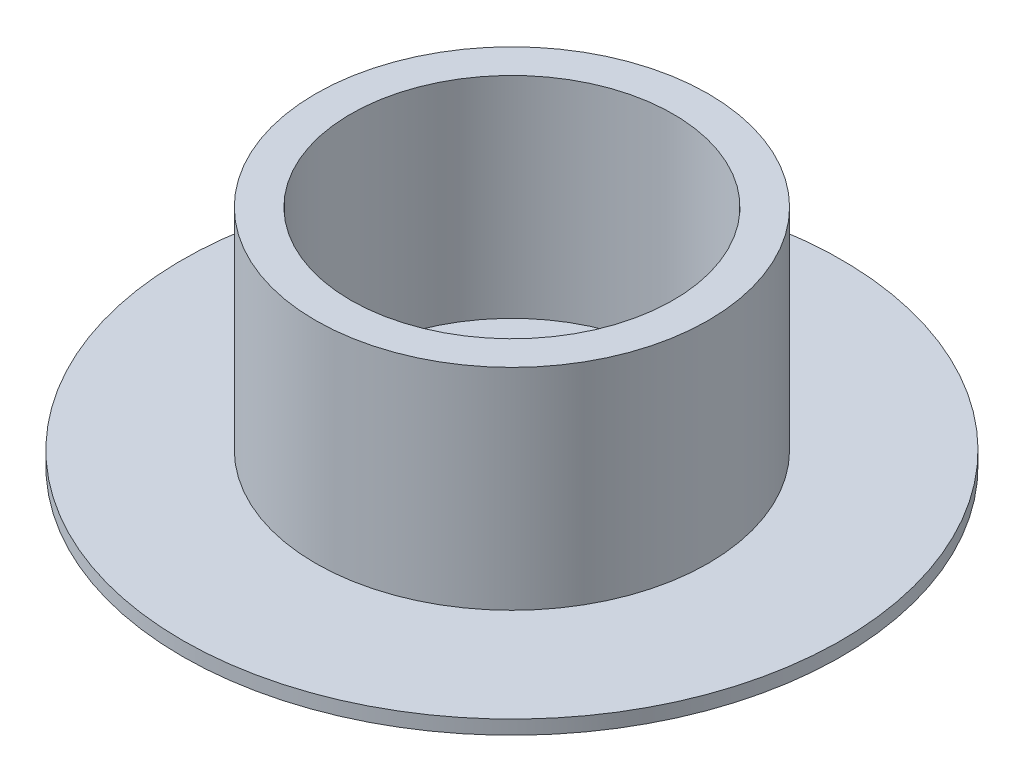
from build123d import *

# Parameters (mm, degrees)
SKETCH_1_R      = 47
EXTRUDE_1_DEPTH = 2
SKETCH_4_R      = 28
SKETCH_4_R_2    = 23
EXTRUDE_2_DEPTH = 30


with BuildPart() as part:
    # Эскиз1 → Бобышка-Вытянуть1 (new body)
    with BuildSketch(Plane(origin=(0, 0, 0), x_dir=(1, 0, 0), z_dir=(0, 1, 0))):
        with Locations(Location((0, 0, 0), (0, 0, 270))):
            Circle(SKETCH_1_R)
    extrude(amount=EXTRUDE_1_DEPTH)

    # Эскиз4 → Бобышка-Вытянуть2 (add)
    with BuildSketch(Plane(origin=(0, 2, 0), x_dir=(1, 0, 0), z_dir=(0, 1, 0))):
        with Locations(Location((0, 0, 0), (0, 0, 270))):
            Circle(SKETCH_4_R)
        with Locations(Location((0, 0, 0), (0, 0, 270))):
            Circle(SKETCH_4_R_2, mode=Mode.SUBTRACT)
    extrude(amount=EXTRUDE_2_DEPTH)


solid = part.part
